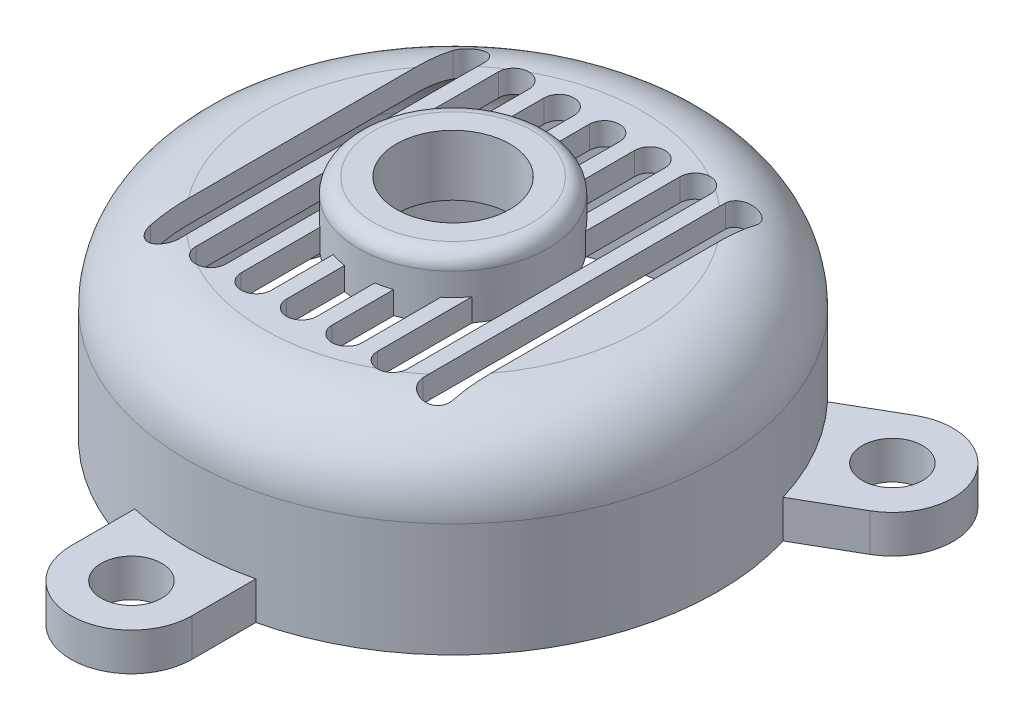
from build123d import *

# Parameters (mm, degrees)
SKETCH1_R                = 35
BOSS_EXTRUDE1_DEPTH      = 25
FILLET1_R                = 10
SHELL1_T                 = -3
SKETCH2_R                = 4
BOSS_EXTRUDE2_DEPTH      = 5
CIRPATTERN1_COUNT        = 3
CUT_EXTRUDE6_DEPTH       = 500
LPATTERN1_COUNT          = 7
LPATTERN1_PITCH          = 6
BOSS_EXTRUDE4_DEPTH      = 5
BOSS_EXTRUDE4_DEPTH_BACK = 3
SKETCH8_R                = 12.5
FILLET2_R                = 2
SKETCH9_R                = 7.5
CUT_EXTRUDE7_DEPTH       = 74.877160033


with BuildPart() as part:
    # Sketch1 → Boss-Extrude1 (new body)
    with BuildSketch(Plane(origin=(0, 0, 0), x_dir=(1, 0, 0), z_dir=(0, 1, 0))):
        with Locations(Location((0, 0, 0), (0, 0, 270))):
            Circle(SKETCH1_R)
    extrude(amount=BOSS_EXTRUDE1_DEPTH)

    # Fillet1
    fillet1_edges = [part.edges().sort_by_distance(p)[0] for p in [
        (0, 25, -35),
    ]]
    fillet(fillet1_edges, radius=FILLET1_R)

    # Shell1
    shell1_openings = [part.faces().sort_by_distance(p)[0] for p in [
        (0, 0, 0),
    ]]
    offset(amount=SHELL1_T, openings=shell1_openings, kind=Kind.INTERSECTION)

    # Sketch2 → Boss-Extrude2 (add)
    with BuildSketch(Plane.XZ):
        with BuildLine():
            Line((-8, 42.5), (-8, 32))
            Line((-8, 32), (8, 32))
            Line((8, 32), (8, 42.5))
            ThreePointArc((8, 42.5), (0, 50.5), (-8, 42.5))
        make_face()
        with Locations(Location((0, 42.5, 0), (0, 0, 270))):
            Circle(SKETCH2_R, mode=Mode.SUBTRACT)
    boss_extrude2 = extrude(amount=-BOSS_EXTRUDE2_DEPTH)

    # CirPattern1: Boss-Extrude2 ×3 about axis
    cirpattern1_axis = Axis((0, 0, 0), (0, 1, 0))
    for i in range(1, CIRPATTERN1_COUNT):
        add(boss_extrude2.rotate(cirpattern1_axis, i * 360 / CIRPATTERN1_COUNT))

    # Sketch3 → Cut-Extrude6 (cut, symmetric)
    with BuildSketch(Plane.XZ.offset(-22)):
        with BuildLine():
            Line((-20, -20), (-20, 20))
            ThreePointArc((-20, 20), (-18, 22), (-16, 20))
            Line((-16, 20), (-16, -20))
            ThreePointArc((-16, -20), (-18, -22), (-20, -20))
        make_face()
    cut_extrude6 = extrude(amount=CUT_EXTRUDE6_DEPTH, both=True, mode=Mode.SUBTRACT)

    # LPattern1: Cut-Extrude6 ×7
    with Locations(*[(i * LPATTERN1_PITCH, 0, 0) for i in range(1, LPATTERN1_COUNT)]):
        add(cut_extrude6, mode=Mode.SUBTRACT)

    # Sketch8 → Boss-Extrude4 (add, two sides: drawn at the far end of the back side and taken through both)
    with BuildSketch(Plane(origin=(0, 25, 0), x_dir=(1, 0, 0), z_dir=(0, 1, 0)).offset(-BOSS_EXTRUDE4_DEPTH_BACK)):
        with Locations(Location((0, 0, 0), (0, 0, 270))):
            Circle(SKETCH8_R)
    extrude(amount=BOSS_EXTRUDE4_DEPTH + BOSS_EXTRUDE4_DEPTH_BACK)

    # Fillet2
    fillet2_edges = [part.edges().sort_by_distance(p)[0] for p in [
        (0, 30, -12.5),
    ]]
    fillet(fillet2_edges, radius=FILLET2_R)

    # Sketch9 → Cut-Extrude7 (cut, through all)
    with BuildSketch(Plane(origin=(0, 30, 0), x_dir=(1, 0, 0), z_dir=(0, 1, 0))):
        with Locations(Location((0, 0, 0), (0, 0, 270))):
            Circle(SKETCH9_R)
    extrude(amount=-CUT_EXTRUDE7_DEPTH, mode=Mode.SUBTRACT)


solid = part.part
